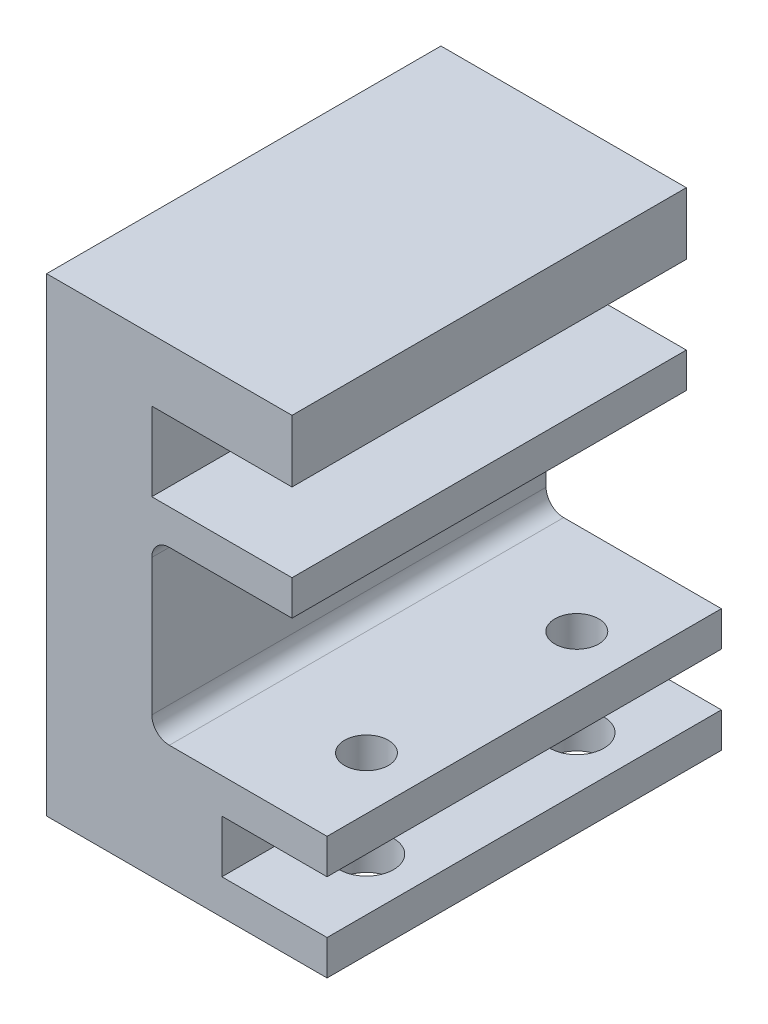
from build123d import *

# Parameters (mm, degrees)
SKETCH1_W                   = 50.8
SKETCH1_H                   = 85.09
BOSS_EXTRUDE1_DEPTH         = 35.7124
CUT_EXTRUDE1_REACH          = 88.93
SKETCH2_W                   = 31.749988824
SKETCH2_H                   = 31.04515
SKETCH4_W                   = 31.749988824
SKETCH4_H                   = 14.224
CUT_EXTRUDE2_DEPTH          = 87.929506383
CUT_EXTRUDE3_REACH          = 88.93
SKETCH5_W                   = 19.05
SKETCH5_H                   = 9.525
CUT_EXTRUDE4_START          = -71.4248
SKETCH6_W                   = 6.35
SKETCH6_H                   = 31.81985
CUT_EXTRUDE4_DEPTH          = 71.4248
F_10_CLEARANCE_HOLE1_D      = 4.9784
F_3_8_CLEARANCE_HOLE1_D     = 9.8044
F_3_8_CLEARANCE_HOLE1_DEPTH = 6.35
F_3_8_16_TAPPED_HOLE1_D     = 7.9375
F_3_8_16_TAPPED_HOLE1_DEPTH = 6.35
FILLET1_R                   = 3.175


with BuildPart() as part:
    # Sketch1 → Boss-Extrude1 (new, symmetric)
    with BuildSketch(Plane.XY):
        Rectangle(SKETCH1_W, SKETCH1_H)
    extrude(amount=BOSS_EXTRUDE1_DEPTH, both=True)

    # Sketch2 → Cut-Extrude1 (cut, up to next)
    with BuildSketch(Plane.XY.offset(35.7124), mode=Mode.PRIVATE) as cut_extrude1_sk1:
        with Locations((9.525005588, -4.797425)):
            Rectangle(SKETCH2_W, SKETCH2_H)
    cut_extrude1_tool1 = extrude(cut_extrude1_sk1.sketch, amount=-CUT_EXTRUDE1_REACH, mode=Mode.PRIVATE) & part.part
    add(cut_extrude1_tool1.solids().sort_by_distance((9.525006, -4.797425, 35.7124))[0], mode=Mode.SUBTRACT)

    # Sketch4 → Cut-Extrude2 (cut, through all)
    with BuildSketch(Plane.XY.offset(35.7124)):
        with Locations((9.525005588, 24.18715)):
            Rectangle(SKETCH4_W, SKETCH4_H)
    extrude(amount=-CUT_EXTRUDE2_DEPTH, mode=Mode.SUBTRACT)

    # Sketch5 → Cut-Extrude3 (cut, up to next)
    with BuildSketch(Plane.XY.offset(35.7124), mode=Mode.PRIVATE) as cut_extrude3_sk1:
        with Locations((15.875, -31.4325)):
            Rectangle(SKETCH5_W, SKETCH5_H)
    cut_extrude3_tool1 = extrude(cut_extrude3_sk1.sketch, amount=-CUT_EXTRUDE3_REACH, mode=Mode.PRIVATE) & part.part
    add(cut_extrude3_tool1.solids().sort_by_distance((15.875, -31.4325, 35.7124))[0], mode=Mode.SUBTRACT)

    # Sketch6 → Cut-Extrude4 (cut)
    with BuildSketch(Plane.XY.offset(35.7124).offset(CUT_EXTRUDE4_START)):
        with Locations((22.225, 26.635075)):
            Rectangle(SKETCH6_W, SKETCH6_H)
    extrude(amount=CUT_EXTRUDE4_DEPTH, mode=Mode.SUBTRACT)

    # #10 Clearance Hole1 (through all)
    with Locations(Plane.ZY.offset(25.4)):
        with Locations((0, 24.13)):
            Hole(F_10_CLEARANCE_HOLE1_D / 2)

    # 3/8 Clearance Hole1
    with Locations(Plane(origin=(0, -42.545, 0), x_dir=(-1, 0, 0), z_dir=(0, -1, 0))):
        with Locations((-15.875, -19.05), (-15.875, 19.05)):
            Hole(F_3_8_CLEARANCE_HOLE1_D / 2, depth=F_3_8_CLEARANCE_HOLE1_DEPTH)

    # 3/8-16 Tapped Hole1
    with Locations(Plane(origin=(0, -20.32, 0), x_dir=(1, 0, 0), z_dir=(0, 1, 0))):
        with Locations((15.875, -19.05), (15.875, 19.05)):
            Hole(F_3_8_16_TAPPED_HOLE1_D / 2, depth=F_3_8_16_TAPPED_HOLE1_DEPTH)

    # Fillet1
    fillet1_edges = [part.edges().sort_by_distance(p)[0] for p in [
        (-6.349988824, -20.32, 0),
        (-6.349988824, 10.72515, 0),
    ]]
    fillet(fillet1_edges, radius=FILLET1_R)


solid = part.part
